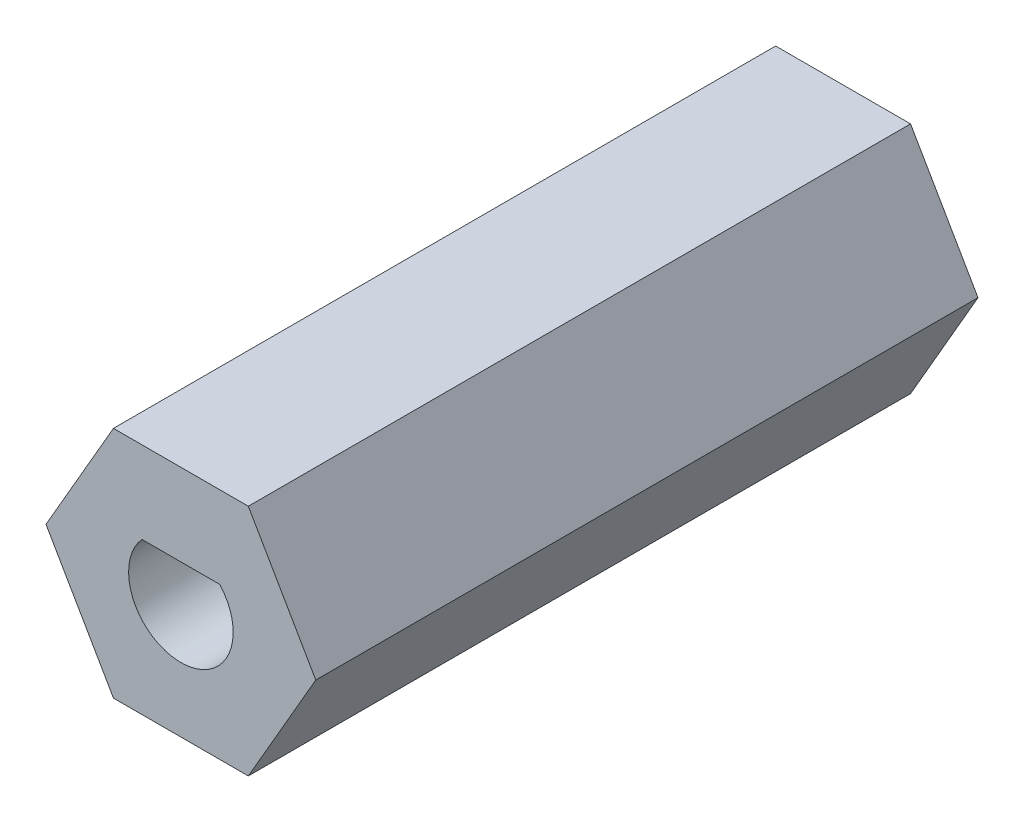
from build123d import *

# Parameters (mm, degrees)
EXTRUDE_1_DEPTH     = 19
CUT_EXTRUDE_1_DEPTH = 8
SKETCH_3_R          = 1.1
CUT_EXTRUDE_2_DEPTH = 8


with BuildPart() as part:
    # 草图1 → 凸台-拉伸1 (new body)
    with BuildSketch(Plane.XY):
        Polygon((-1.935, 3.351518313), (1.935, 3.351518313), (3.87, 0), (1.935, -3.351518313), (-1.935, -3.351518313), (-3.87, 0), align=None)
    extrude(amount=EXTRUDE_1_DEPTH)

    # 草图2 → 切除-拉伸1 (cut)
    with BuildSketch(Plane.XY.offset(19)):
        with BuildLine():
            Line((-1.118033989, 1), (1.118033989, 1))
            ThreePointArc((1.118033989, 1), (0, -1.5), (-1.118033989, 1))
        make_face()
    extrude(amount=-CUT_EXTRUDE_1_DEPTH, mode=Mode.SUBTRACT)

    # 草图3 → 切除-拉伸2 (cut)
    with BuildSketch(Plane(origin=(0, 0, 0), x_dir=(-1, 0, 0), z_dir=(0, 0, -1))):
        Circle(SKETCH_3_R)
    extrude(amount=-CUT_EXTRUDE_2_DEPTH, mode=Mode.SUBTRACT)


solid = part.part
